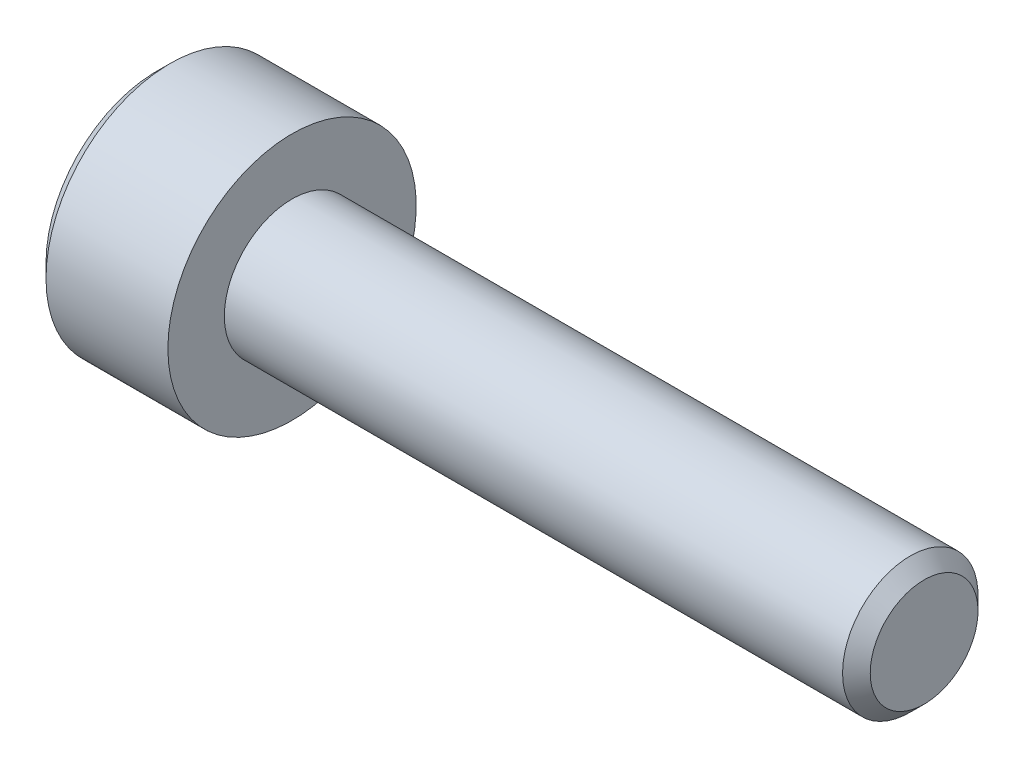
from build123d import *

# Parameters (mm, degrees)
CUT_EXTRUDE1_DEPTH = 1.5


with BuildPart() as part:
    # Sketch1 → Revolve1 (revolve)
    with BuildSketch(Plane.XY):
        Polygon((-3, 0), (14, 0), (14, -1.1935), (13.6935, -1.5), (0, -1.5), (0, -2.75), (-2.7, -2.75), (-3, -2.45), align=None)
    revolve(axis=Axis((-3.85, 0, 0), (1, 0, 0)))

    # Sketch2 → Cut-Extrude1 (cut)
    with BuildSketch(Plane.ZY.offset(3)):
        Polygon((0, 1.443375673), (-1.25, 0.721687836), (-1.25, -0.721687836), (0, -1.443375673), (1.25, -0.721687836), (1.25, 0.721687836), align=None)
    extrude(amount=-CUT_EXTRUDE1_DEPTH, mode=Mode.SUBTRACT)


solid = part.part
